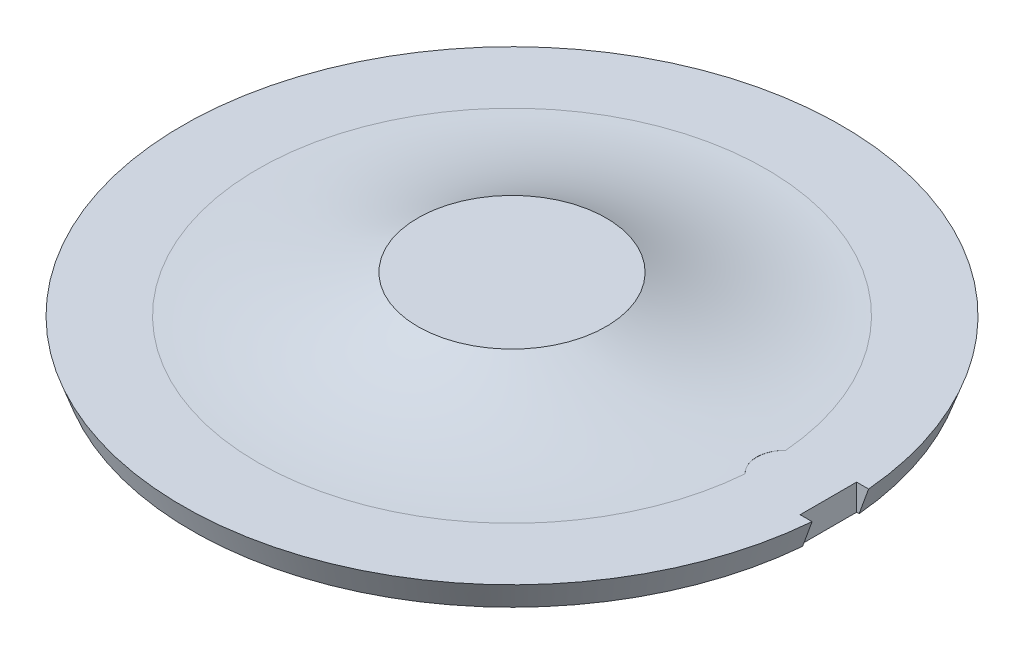
from build123d import *

# Parameters (mm, degrees)
SKETCH3_W          = 76.2
SKETCH3_H          = 35.252279458
CUT_EXTRUDE1_DEPTH = 982.839871475
CUT_EXTRUDE2_DEPTH = 635.48049207
CUT_EXTRUDE3_DEPTH = 635.48049207


with BuildPart() as part:
    # Sketch2 → Revolve3 (revolve)
    with BuildSketch(Plane.XY, mode=Mode.PRIVATE) as revolve3_sk:
        with BuildLine():
            Line((431.799904354, 0), (444.5, 35.252279458))
            Line((444.5, 35.252279458), (342.9, 35.252279458))
            ThreePointArc((342.9, 35.252279458), (232.002017602, 48.123354266), (127, 86.052279458))
            Line((127, 86.052279458), (0, 86.052279458))
            Line((0, 86.052279458), (0, 0))
            Line((0, 0), (0, -50.8))
            Line((0, -50.8), (88.9, -50.8))
            ThreePointArc((88.9, -50.8), (187.373067859, -12.892468613), (292.099904354, 0))
            Line((292.099904354, 0), (431.799904354, 0))
        make_face()
    revolve(revolve3_sk.sketch.rotate(Axis((0, 86.052279458, 0), (0, -1, 0)), 90), axis=Axis((0, 86.052279458, 0), (0, -1, 0)))

    # Sketch3 → Cut-Extrude1 (cut, through all)
    with BuildSketch(Plane(origin=(426.72, 0, 0), x_dir=(0, 0, -1), z_dir=(1, 0, 0))):
        with Locations((0, 17.626139729)):
            Rectangle(SKETCH3_W, SKETCH3_H)
    extrude(amount=CUT_EXTRUDE1_DEPTH, mode=Mode.SUBTRACT)

    # Sketch4 → Cut-Extrude2 (cut, through all)
    with BuildSketch(Plane(origin=(0, 35.252279458, 0), x_dir=(1, 0, 0), z_dir=(0, 1, 0))):
        with BuildLine():
            Line((426.72, -38.1), (368.3, -38.1))
            ThreePointArc((368.3, -38.1), (330.2, 0), (368.3, 38.1))
            Line((368.3, 38.1), (426.72, 38.1))
            Line((426.72, 38.1), (426.72, -38.1))
        make_face()
    extrude(amount=CUT_EXTRUDE2_DEPTH, mode=Mode.SUBTRACT)

    # Sketch5 → Cut-Extrude3 (cut, through all)
    with BuildSketch(Plane.XZ):
        with BuildLine():
            Line((426.72, -38.1), (287.02, -38.1))
            ThreePointArc((287.02, -38.1), (248.92, 0), (287.02, 38.1))
            Line((287.02, 38.1), (426.72, 38.1))
            Line((426.72, 38.1), (426.72, -38.1))
        make_face()
    extrude(amount=CUT_EXTRUDE3_DEPTH, mode=Mode.SUBTRACT)


solid = part.part
